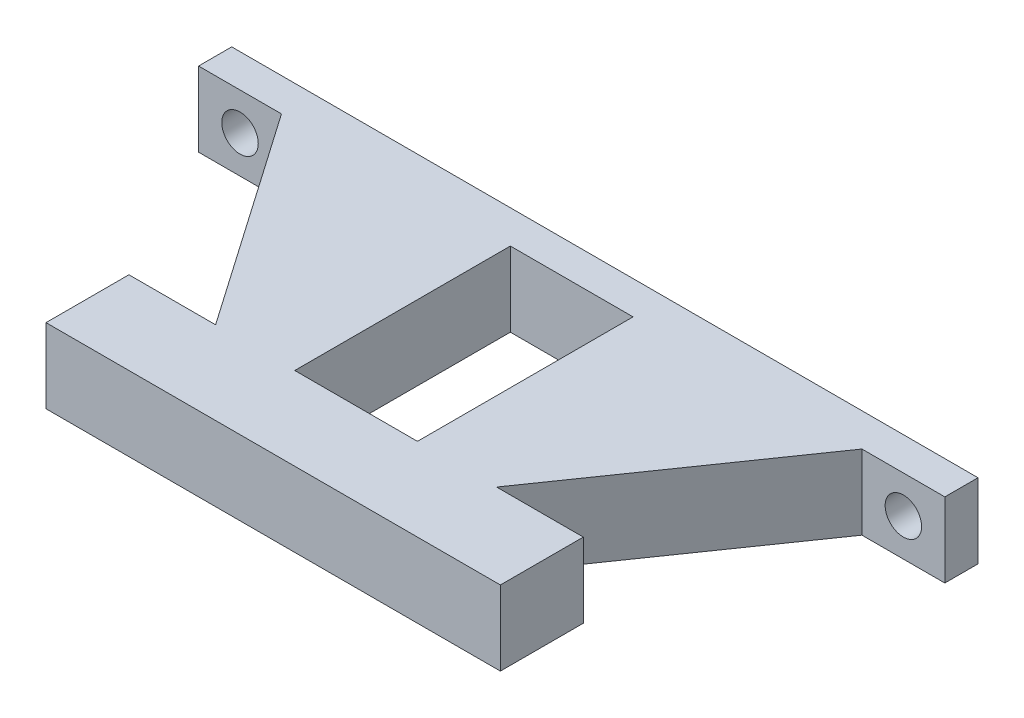
from build123d import *

# Parameters (mm, degrees)
SKETCH1_R           = 2.794
BOSS_EXTRUDE1_DEPTH = 5.08
SKETCH3_W           = 25.4
SKETCH3_H           = 11.43
BOSS_EXTRUDE2_DEPTH = 45.72
SKETCH4_W           = 22.096687199
SKETCH4_H           = 11.43
BOSS_EXTRUDE3_DEPTH = 12.7
BOSS_EXTRUDE5_DEPTH = 11.43
SKETCH7_W           = 18.793374398
SKETCH7_H           = 33.02
CUT_EXTRUDE3_DEPTH  = 12.7


with BuildPart() as part:
    # Sketch1 → Boss-Extrude1 (new body)
    with BuildSketch(Plane.XY):
        Polygon((-57.15, 2.54), (-57.15, -2.54), (-57.15, -5.715), (57.15, -5.715), (57.15, -2.54), (57.15, 2.54), (57.15, 5.715), (-57.15, 5.715), align=None)
        with Locations((50.8, 0)):
            Circle(SKETCH1_R, mode=Mode.SUBTRACT)
        with Locations((-50.8, 0)):
            Circle(SKETCH1_R, mode=Mode.SUBTRACT)
    extrude(amount=BOSS_EXTRUDE1_DEPTH)

    # Sketch3 → Boss-Extrude2 (add)
    with BuildSketch(Plane.XY.offset(5.08)):
        Rectangle(SKETCH3_W, SKETCH3_H)
    extrude(amount=BOSS_EXTRUDE2_DEPTH)

    # Sketch4 → Boss-Extrude3 (add)
    with BuildSketch(Plane.XY.offset(50.8)):
        with Locations((23.7483436, 0)):
            Rectangle(SKETCH4_W, SKETCH4_H)
        with Locations((-23.7483436, 0)):
            Rectangle(SKETCH4_W, SKETCH4_H)
    extrude(amount=-BOSS_EXTRUDE3_DEPTH)

    # Sketch5 → Boss-Extrude5 (add)
    with BuildSketch(Plane.XZ.offset(5.715)):
        Polygon((-44.45, 5.08), (-12.7, 5.08), (-12.7, 38.1), (-21.519444444, 38.1), align=None)
        Polygon((12.7, 38.1), (12.7, 5.08), (44.45, 5.08), (21.519444444, 38.1), align=None)
    extrude(amount=-BOSS_EXTRUDE5_DEPTH)

    # Sketch7 → Cut-Extrude3 (cut)
    with BuildSketch(Plane.XZ.offset(5.715)):
        with Locations((0, 21.59)):
            Rectangle(SKETCH7_W, SKETCH7_H)
    extrude(amount=-CUT_EXTRUDE3_DEPTH, mode=Mode.SUBTRACT)


solid = part.part
